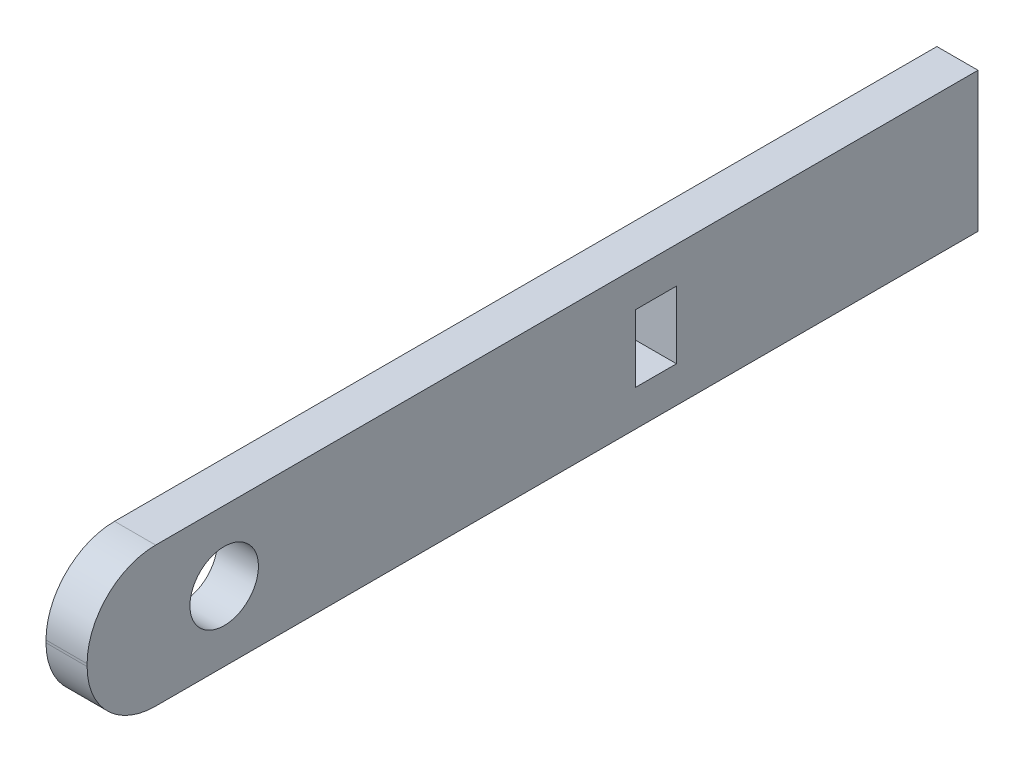
from build123d import *

# Parameters (mm, degrees)
SKETCH1_W                 = 65
SKETCH1_H                 = 10.18
BOSS_EXTRUDE1_DEPTH       = 3
F_5_0MM_DOWEL_HOLE1_D     = 5
F_5_0MM_DOWEL_HOLE1_DEPTH = 3
F_5_0MM_DOWEL_HOLE1_TIP   = 1.502151548
FILLET1_R                 = 5
SKETCH4_W                 = 3
SKETCH4_H                 = 4.91
CUT_EXTRUDE1_DEPTH        = 3


with BuildPart() as part:
    # Sketch1 → Boss-Extrude1 (new body)
    with BuildSketch(Plane(origin=(0, 0, 0), x_dir=(0, 0, -1), z_dir=(1, 0, 0))):
        with Locations((32.5, 5.09)):
            Rectangle(SKETCH1_W, SKETCH1_H)
    extrude(amount=BOSS_EXTRUDE1_DEPTH)

    # Ø5.0mm Dowel Hole1
    with Locations(Plane(origin=(3, 0, 0), x_dir=(0, 0, -1), z_dir=(1, 0, 0))):
        with Locations((10, 5.09)):
            Hole(F_5_0MM_DOWEL_HOLE1_D / 2, depth=F_5_0MM_DOWEL_HOLE1_DEPTH)
            with Locations((0, 0, -(F_5_0MM_DOWEL_HOLE1_DEPTH + F_5_0MM_DOWEL_HOLE1_TIP / 2))):  # 118° drill point
                Cone(0, F_5_0MM_DOWEL_HOLE1_D / 2, F_5_0MM_DOWEL_HOLE1_TIP, mode=Mode.SUBTRACT)

    # Fillet1
    fillet1_edges = [part.edges().sort_by_distance(p)[0] for p in [
        (1.5, 10.18, 0),
        (1.5, 0, 0),
    ]]
    fillet(fillet1_edges, radius=FILLET1_R)

    # Sketch4 → Cut-Extrude1 (cut)
    with BuildSketch(Plane(origin=(3, 0, 0), x_dir=(0, 0, -1), z_dir=(1, 0, 0))):
        with Locations((41.5, 5.09)):
            Rectangle(SKETCH4_W, SKETCH4_H)
    extrude(amount=-CUT_EXTRUDE1_DEPTH, mode=Mode.SUBTRACT)


solid = part.part
